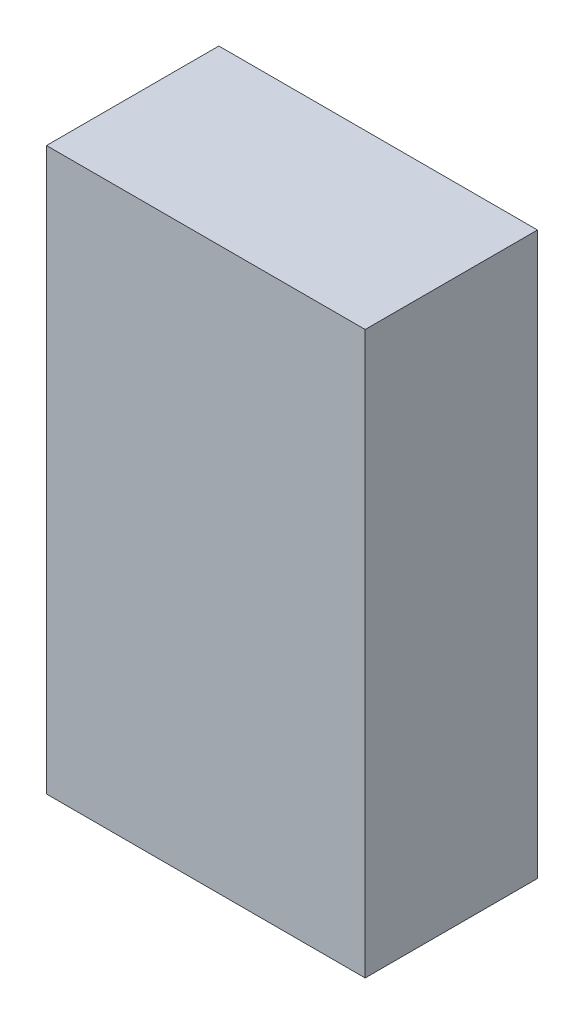
from build123d import *

# Parameters (mm, degrees)
SKETCH1_W           = 284.686
SKETCH1_H           = 501.743501487
BOSS_EXTRUDE1_DEPTH = 153.963811273


with BuildPart() as part:
    # Sketch1 → Boss-Extrude1 (new body)
    with BuildSketch(Plane.XY):
        with Locations((-139.343, -198.274382667)):
            Rectangle(SKETCH1_W, SKETCH1_H)
    extrude(amount=-BOSS_EXTRUDE1_DEPTH)


solid = part.part
